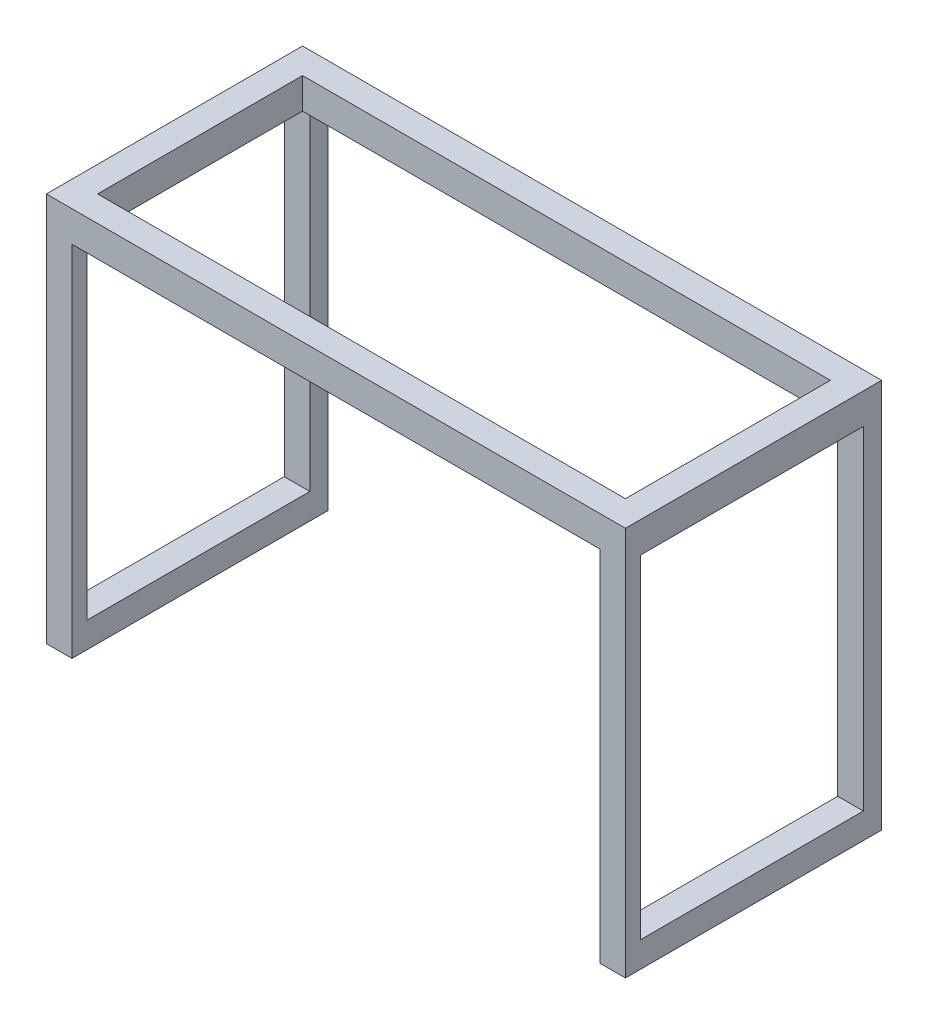
from build123d import *

# Parameters (mm, degrees)
SKETCH1_W           = 1130
SKETCH1_H           = 500
BOSS_EXTRUDE1_DEPTH = 60
SKETCH2_W           = 1030
SKETCH2_H           = 400
CUT_EXTRUDE1_DEPTH  = 60
SKETCH3_W           = 50
SKETCH3_H           = 500
BOSS_EXTRUDE3_DEPTH = 700
SKETCH5_W           = 434.818131318
SKETCH5_H           = 650
CUT_EXTRUDE2_DEPTH  = 1902


with BuildPart() as part:
    # Sketch1 → Boss-Extrude1 (new body)
    with BuildSketch(Plane(origin=(0, 0, 0), x_dir=(1, 0, 0), z_dir=(0, 1, 0))):
        Rectangle(SKETCH1_W, SKETCH1_H)
    extrude(amount=BOSS_EXTRUDE1_DEPTH)

    # Sketch2 → Cut-Extrude1 (cut)
    with BuildSketch(Plane(origin=(0, 60, 0), x_dir=(1, 0, 0), z_dir=(0, 1, 0))):
        Rectangle(SKETCH2_W, SKETCH2_H)
    extrude(amount=-CUT_EXTRUDE1_DEPTH, mode=Mode.SUBTRACT)

    # Sketch3 → Boss-Extrude3 (add)
    with BuildSketch(Plane(origin=(0, 0, 0), x_dir=(-1, 0, 0), z_dir=(0, -1, 0))):
        with Locations((540, 0)):
            Rectangle(SKETCH3_W, SKETCH3_H)
        with Locations((-540, 0)):
            Rectangle(SKETCH3_W, SKETCH3_H)
    extrude(amount=BOSS_EXTRUDE3_DEPTH)

    # Sketch5 → Cut-Extrude2 (cut)
    with BuildSketch(Plane.ZY.offset(565)):
        with Locations((3.135707678, -325)):
            Rectangle(SKETCH5_W, SKETCH5_H)
    extrude(amount=-CUT_EXTRUDE2_DEPTH, mode=Mode.SUBTRACT)


solid = part.part
